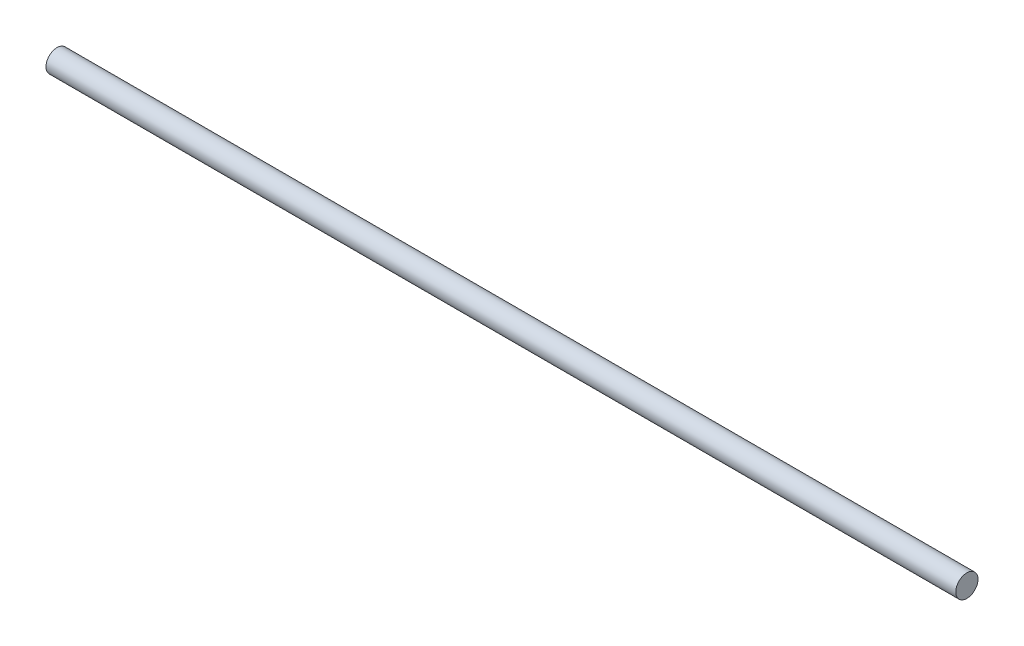
from build123d import *

# Parameters (mm, degrees)
SKETCH1_R           = 3
BOSS_EXTRUDE1_DEPTH = 245.428096465


with BuildPart() as part:
    # Sketch1 → Boss-Extrude1 (new body)
    with BuildSketch(Plane.ZY.offset(204.571903535)):
        with Locations(Location((-1, 149.45, 0), (0, 0, 180))):
            Circle(SKETCH1_R)
    extrude(amount=BOSS_EXTRUDE1_DEPTH)


solid = part.part
